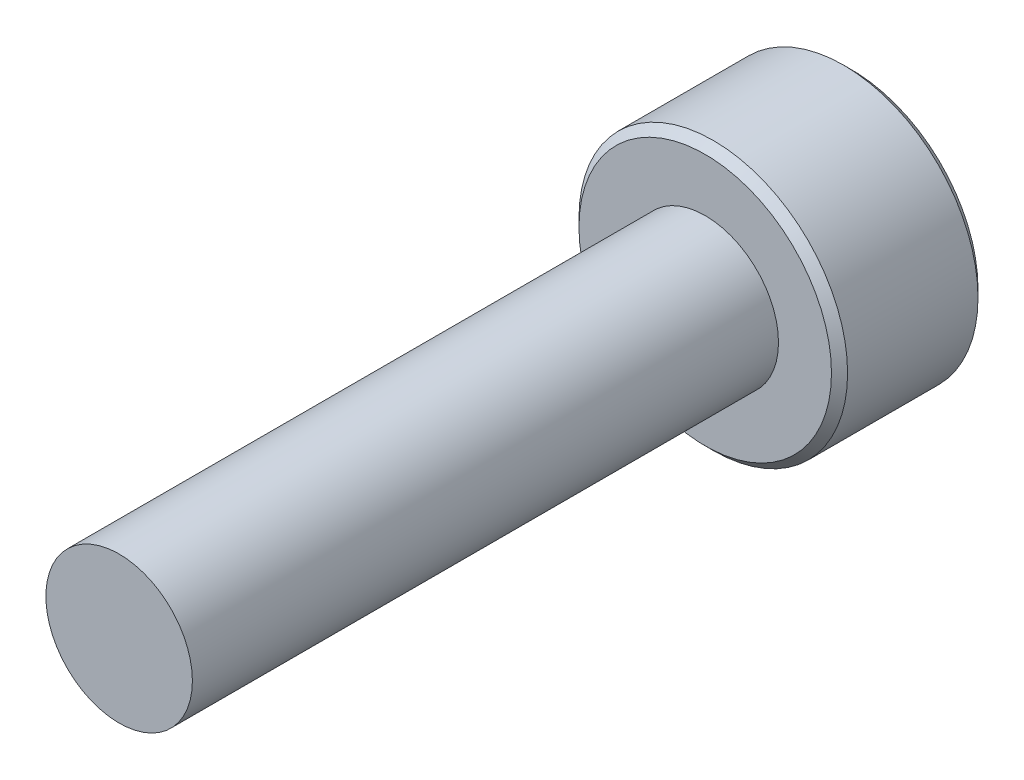
from build123d import *

# Parameters (mm, degrees)
SKETCH1_R          = 1.5
EXTRUDE1_DEPTH     = 12
SKETCH6_R          = 2.75
EXTRUDE2_DEPTH     = 3
CUT_EXTRUDE1_DEPTH = 1.875
CHAMFER1_SIZE      = 0.165


with BuildPart() as part:
    # Sketch1 → Extrude1 (new body)
    with BuildSketch(Plane.XY):
        Circle(SKETCH1_R)
    extrude(amount=-EXTRUDE1_DEPTH)

    # Sketch6 → Extrude2 (add)
    with BuildSketch(Plane(origin=(0, 0, -12), x_dir=(-1, 0, 0), z_dir=(0, 0, -1))):
        Circle(SKETCH6_R)
    extrude(amount=EXTRUDE2_DEPTH)

    # Sketch7 → Cut-Extrude1 (cut)
    with BuildSketch(Plane(origin=(0, 0, -15), x_dir=(-1, 0, 0), z_dir=(0, 0, -1))):
        Polygon((0, 1.443375673), (-1.25, 0.721687836), (-1.25, -0.721687836), (0, -1.443375673), (1.25, -0.721687836), (1.25, 0.721687836), align=None)
    extrude(amount=-CUT_EXTRUDE1_DEPTH, mode=Mode.SUBTRACT)

    # Cut-Extrude2 cone 1 section (through the dimple's axis) → Cut-Extrude2 (revolve, cut)
    with BuildSketch(Plane(origin=(0, 0, -15), x_dir=(0, 1, 0), z_dir=(1, 0, 0))):
        Polygon((0, 0), (1.443375673, 0), (0, 1.443375673), align=None)
    revolve(axis=Axis((0, 0, -15), (0, 0, 1)), mode=Mode.SUBTRACT)

    # Chamfer1
    chamfer1_edges = [part.edges().sort_by_distance(p)[0] for p in [
        (2.75, 0, -12),
        (2.75, 0, -15),
    ]]
    chamfer(chamfer1_edges, length=CHAMFER1_SIZE)

    # Sketch10 → Revolve1 (revolve)
    with BuildSketch(Plane(origin=(0, 0, 0), x_dir=(0, 0, -1), z_dir=(1, 0, 0))):
        Polygon((12, 1.5), (12, 0), (11.253679656, 0), (11.875, 1.5), align=None)
    revolve(axis=Axis((0, 0, -12), (0, 0, 1)))


solid = part.part
